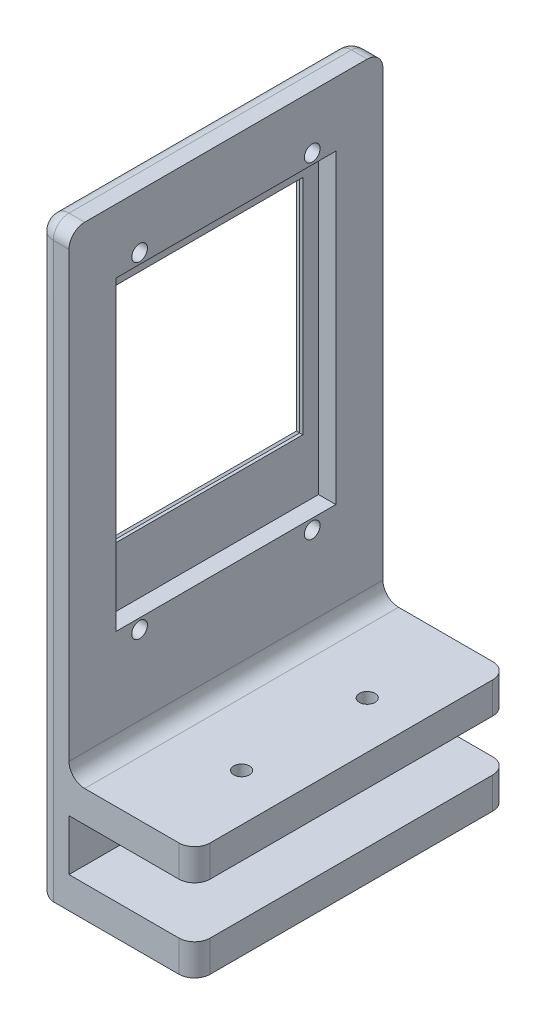
from build123d import *
from OCP.BRepFilletAPI import BRepFilletAPI_MakeChamfer

# Parameters (mm, degrees)
BOSS_EXTRUDE7_DEPTH = 25.4
SKETCH14_W          = 30.48
SKETCH14_H          = 36.068
CUT_EXTRUDE3_DEPTH  = 66.482787481
SKETCH15_W          = 35.56
SKETCH15_H          = 49.53
CUT_EXTRUDE4_DEPTH  = 2.794
CHAMFER1_SIZE       = 1.778
CHAMFER1_SIZE2      = 1.244969003
SKETCH16_R          = 1.27
CUT_EXTRUDE5_DEPTH  = 66.482787481
FILLET4_R           = 2.54
FILLET5_R           = 2.54
SKETCH23_R          = 1.778
CUT_EXTRUDE6_DEPTH  = 96.857661666
FILLET6_R           = 2.54
CUT_EXTRUDE7_REACH  = 85.437
SKETCH24_R          = 1.27
FILLET7_R           = 2.54


with BuildPart() as part:
    # Sketch12 → Boss-Extrude7 (new, symmetric)
    with BuildSketch(Plane.XY):
        Polygon((0, -38.4175), (20.32, -38.4175), (20.32, -43.4975), (0, -43.4975), (0, -51.7525), (20.32, -51.7525), (20.32, -56.8325), (-5.08, -56.8325), (-5.08, 38.4175), (0, 38.4175), align=None)
    extrude(amount=BOSS_EXTRUDE7_DEPTH, both=True)

    # Sketch14 → Cut-Extrude3 (cut, through all)
    with BuildSketch(Plane(origin=(0, 0, 0), x_dir=(0, 0, -1), z_dir=(1, 0, 0))):
        with Locations((0, 6.2103)):
            Rectangle(SKETCH14_W, SKETCH14_H)
    extrude(amount=-CUT_EXTRUDE3_DEPTH, mode=Mode.SUBTRACT)

    # Sketch15 → Cut-Extrude4 (cut)
    with BuildSketch(Plane(origin=(0, 0, 0), x_dir=(0, 0, -1), z_dir=(1, 0, 0))):
        with Locations((0, 3.2893)):
            Rectangle(SKETCH15_W, SKETCH15_H)
    extrude(amount=-CUT_EXTRUDE4_DEPTH, mode=Mode.SUBTRACT)

    # Chamfer1: one chamfer whose edges measure the first distance from different faces: ONE call of the kernel's chamfer builder (chamfer() names one face for all edges)
    chamfer1_edges_1 = [part.edges().sort_by_distance(p)[0] for p in [
        (-5.08, 6.2103, -15.24),
    ]]
    chamfer1_side_1 = [part.faces().sort_by_distance(p)[0] for p in [
        (-3.937, 6.2103, -15.24),
    ]]
    chamfer1_edges_2 = [part.edges().sort_by_distance(p)[0] for p in [
        (-5.08, -11.8237, 0),
    ]]
    chamfer1_side_2 = [part.faces().sort_by_distance(p)[0] for p in [
        (-3.937, -11.8237, 0),
    ]]
    chamfer1_edges_3 = [part.edges().sort_by_distance(p)[0] for p in [
        (-5.08, 6.2103, 15.24),
    ]]
    chamfer1_side_3 = [part.faces().sort_by_distance(p)[0] for p in [
        (-3.937, 6.2103, 15.24),
    ]]
    chamfer1_edges_4 = [part.edges().sort_by_distance(p)[0] for p in [
        (-5.08, 24.2443, 0),
    ]]
    chamfer1_side_4 = [part.faces().sort_by_distance(p)[0] for p in [
        (-3.937, 24.2443, 0),
    ]]
    chamfer1 = BRepFilletAPI_MakeChamfer(part.part.solid().wrapped)
    for e in chamfer1_edges_1:
        chamfer1.Add(CHAMFER1_SIZE, CHAMFER1_SIZE2, e.wrapped, chamfer1_side_1[0].wrapped)  # the first distance lies on this face
    for e in chamfer1_edges_2:
        chamfer1.Add(CHAMFER1_SIZE, CHAMFER1_SIZE2, e.wrapped, chamfer1_side_2[0].wrapped)  # the first distance lies on this face
    for e in chamfer1_edges_3:
        chamfer1.Add(CHAMFER1_SIZE, CHAMFER1_SIZE2, e.wrapped, chamfer1_side_3[0].wrapped)  # the first distance lies on this face
    for e in chamfer1_edges_4:
        chamfer1.Add(CHAMFER1_SIZE, CHAMFER1_SIZE2, e.wrapped, chamfer1_side_4[0].wrapped)  # the first distance lies on this face
    add(Compound.cast(chamfer1.Shape()), mode=Mode.REPLACE)

    # Sketch16 → Cut-Extrude5 (cut, through all)
    with BuildSketch(Plane(origin=(0, 0, 0), x_dir=(0, 0, -1), z_dir=(1, 0, 0))):
        with Locations((-13.97, 29.7053)):
            Circle(SKETCH16_R)
        with Locations((13.97, 29.7053)):
            Circle(SKETCH16_R)
        with Locations((-13.97, -23.1267)):
            Circle(SKETCH16_R)
        with Locations((13.97, -23.1267)):
            Circle(SKETCH16_R)
    extrude(amount=-CUT_EXTRUDE5_DEPTH, mode=Mode.SUBTRACT)

    # Fillet4
    fillet4_edges = [part.edges().sort_by_distance(p)[0] for p in [
        (-2.54, 38.4175, 25.4),
        (-2.54, 38.4175, -25.4),
    ]]
    fillet(fillet4_edges, radius=FILLET4_R)

    # Fillet5
    fillet5_edges = [part.edges().sort_by_distance(p)[0] for p in [
        (20.32, -54.2925, 25.4),
        (20.32, -40.9575, -25.4),
        (20.32, -54.2925, -25.4),
        (20.32, -40.9575, 25.4),
    ]]
    fillet(fillet5_edges, radius=FILLET5_R)

    # Sketch23 → Cut-Extrude6 (cut, through all)
    with BuildSketch(Plane(origin=(0, -51.7525, 0), x_dir=(1, 0, 0), z_dir=(0, 1, 0))):
        with Locations(Location((8.89, 15.24, 0), (0, 0, 180))):
            Circle(SKETCH23_R)
        with Locations(Location((8.89, -15.24, 0), (0, 0, 180))):
            Circle(SKETCH23_R)
    extrude(amount=-CUT_EXTRUDE6_DEPTH, mode=Mode.SUBTRACT)

    # Fillet6
    fillet6_edges = [part.edges().sort_by_distance(p)[0] for p in [
        (-5.08, -56.8325, 0),
        (-5.08, 38.4175, 0),
        (-5.08, -10.4775, -25.4),
        (-5.08, -10.4775, 25.4),
        (-5.08, 37.673551224, 24.656051224),
        (-5.08, 37.673551224, -24.656051224),
    ]]
    fillet(fillet6_edges, radius=FILLET6_R)

    # Sketch24 → Cut-Extrude7 (cut, up to next)
    with BuildSketch(Plane(origin=(0, -38.4175, 0), x_dir=(1, 0, 0), z_dir=(0, 1, 0)), mode=Mode.PRIVATE) as cut_extrude7_sk1:
        with Locations(Location((12.7, 10.16, 0), (0, 0, 180))):
            Circle(SKETCH24_R)
    cut_extrude7_tool1 = extrude(cut_extrude7_sk1.sketch, amount=-CUT_EXTRUDE7_REACH, mode=Mode.PRIVATE) & part.part
    # Sketch24 → Cut-Extrude7 (cut, up to next)
    with BuildSketch(Plane(origin=(0, -38.4175, 0), x_dir=(1, 0, 0), z_dir=(0, 1, 0)), mode=Mode.PRIVATE) as cut_extrude7_sk2:
        with Locations(Location((12.7, -10.16, 0), (0, 0, 180))):
            Circle(SKETCH24_R)
    cut_extrude7_tool2 = extrude(cut_extrude7_sk2.sketch, amount=-CUT_EXTRUDE7_REACH, mode=Mode.PRIVATE) & part.part
    add(cut_extrude7_tool1.solids().sort_by_distance((12.7, -38.4175, -10.16))[0], mode=Mode.SUBTRACT)
    add(cut_extrude7_tool2.solids().sort_by_distance((12.7, -38.4175, 10.16))[0], mode=Mode.SUBTRACT)

    # Fillet7
    fillet7_edges = [part.edges().sort_by_distance(p)[0] for p in [
        (0, -38.4175, 0),
    ]]
    fillet(fillet7_edges, radius=FILLET7_R)


solid = part.part
